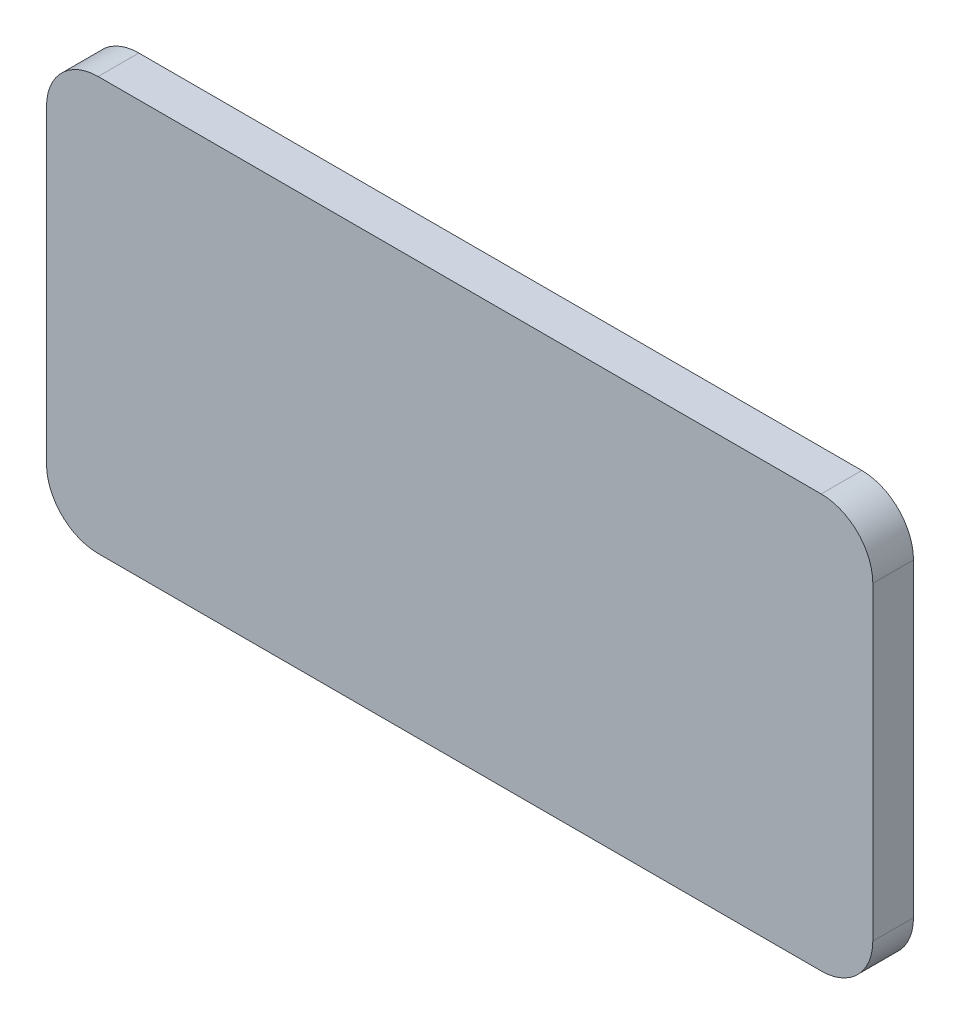
from build123d import *

# Parameters (mm, degrees)
SKETCH1_W           = 40.64
SKETCH1_H           = 20.32
BOSS_EXTRUDE1_DEPTH = 2
FILLET1_R           = 2.54
SKETCH3_W           = 21.9202
SKETCH3_H           = 14.2494
BOSS_EXTRUDE3_DEPTH = 2.064


with BuildPart() as part:
    # Sketch1 → Boss-Extrude1 (new body)
    with BuildSketch(Plane.XY):
        Rectangle(SKETCH1_W, SKETCH1_H)
    extrude(amount=BOSS_EXTRUDE1_DEPTH)

    # Fillet1
    fillet1_edges = [part.edges().sort_by_distance(p)[0] for p in [
        (20.32, -10.16, 1),
        (-20.32, -10.16, 1),
        (-20.32, 10.16, 1),
        (20.32, 10.16, 1),
    ]]
    fillet(fillet1_edges, radius=FILLET1_R)

    # Sketch3 → Boss-Extrude3 (add)
    with BuildSketch(Plane.XY):
        with Locations((3.1369, 0)):
            Rectangle(SKETCH3_W, SKETCH3_H)
    extrude(amount=-BOSS_EXTRUDE3_DEPTH)


solid = part.part
